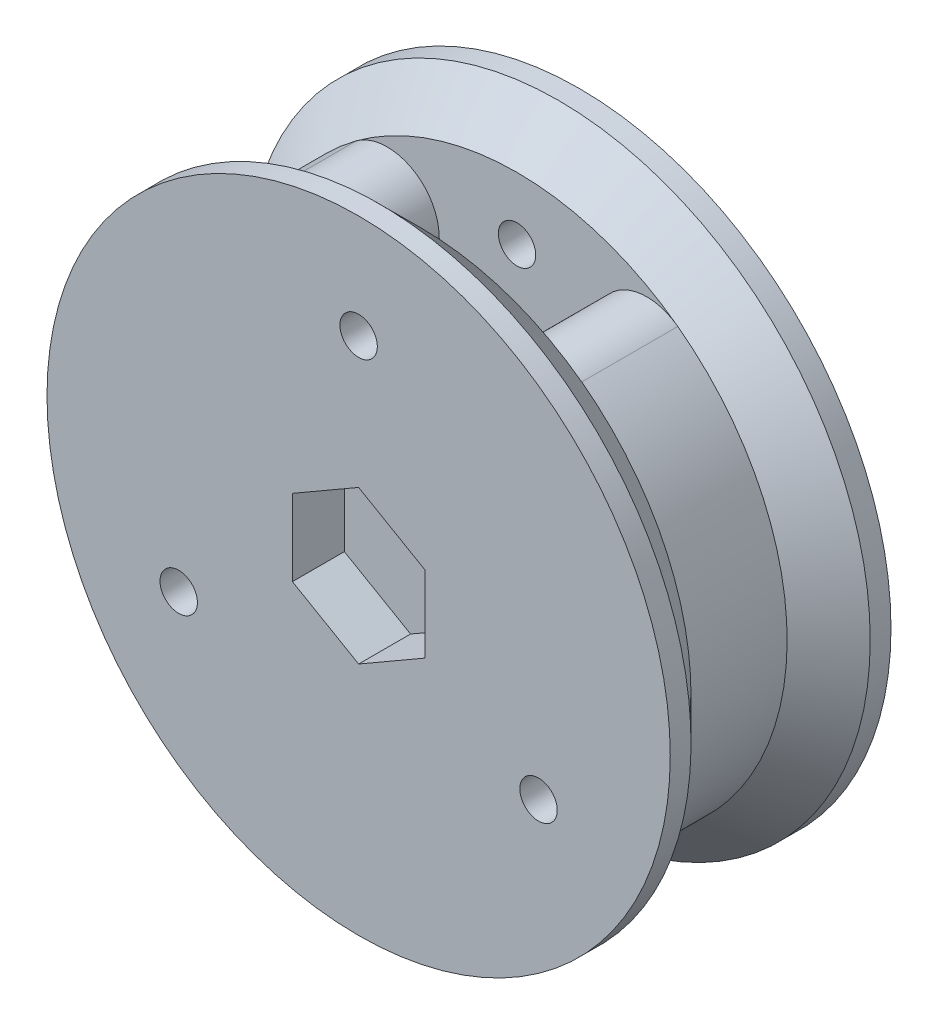
from build123d import *

# Parameters (mm, degrees)
SKETCH1_R           = 30
BOSS_EXTRUDE1_DEPTH = 21.25
CUT_EXTRUDE1_DEPTH  = 5
SKETCH5_R           = 1.8
CUT_EXTRUDE2_DEPTH  = 48.45063224
CUT_EXTRUDE3_DEPTH  = 13
SKETCH10_W          = 15
SKETCH10_H          = 9.25
CUT_EXTRUDE6_DEPTH  = 28
FILLET6_R           = 5
FILLET7_R           = 5


with BuildPart() as part:
    # Sketch1 → Boss-Extrude1 (new body)
    with BuildSketch(Plane.XY):
        Circle(SKETCH1_R)
    extrude(amount=BOSS_EXTRUDE1_DEPTH)

    # Sketch2 → Cut-Extrude1 (cut)
    with BuildSketch(Plane.XY.offset(21.25)):
        Polygon((0, 7.361215932), (-6.375, 3.680607966), (-6.375, -3.680607966), (0, -7.361215932), (6.375, -3.680607966), (6.375, 3.680607966), align=None)
    extrude(amount=-CUT_EXTRUDE1_DEPTH, mode=Mode.SUBTRACT)

    # Sketch4 → Cut-Revolve1 (revolve, cut)
    with BuildSketch(Plane(origin=(0, 0, 0), x_dir=(1, 0, 0), z_dir=(0, 1, 0)), mode=Mode.PRIVATE) as cut_revolve1_sk:
        Polygon((30, -19.25), (26, -15.25), (26, -6), (30, -2), align=None)
    revolve(cut_revolve1_sk.sketch.rotate(Axis((0, 0, -12.64061748), (0, 0, 1)), 180), axis=Axis((0, 0, -12.64061748), (0, 0, 1)), mode=Mode.SUBTRACT)

    # Sketch5 → Cut-Extrude2 (cut, through all)
    with BuildSketch(Plane.XY.offset(21.25)):
        with Locations((-17.320508076, -10)):
            Circle(SKETCH5_R)
        with Locations((17.320508076, -10)):
            Circle(SKETCH5_R)
        with Locations((0, 20)):
            Circle(SKETCH5_R)
    extrude(amount=-CUT_EXTRUDE2_DEPTH, mode=Mode.SUBTRACT)

    # Sketch6 → Cut-Extrude3 (cut)
    with BuildSketch(Plane(origin=(0, 0, 0), x_dir=(-1, 0, 0), z_dir=(0, 0, -1))):
        Polygon((7.361215932, 0), (3.680607966, 6.375), (-3.680607966, 6.375), (-7.361215932, 0), (-3.680607966, -6.375), (3.680607966, -6.375), align=None)
    extrude(amount=-CUT_EXTRUDE3_DEPTH, mode=Mode.SUBTRACT)

    # Sketch10 → Cut-Extrude6 (cut)
    with BuildSketch(Plane(origin=(0, 40, 0), x_dir=(1, 0, 0), z_dir=(0, 1, 0))):
        with Locations((0, -10.625)):
            Rectangle(SKETCH10_W, SKETCH10_H)
    extrude(amount=-CUT_EXTRUDE6_DEPTH, mode=Mode.SUBTRACT)

    # Fillet6
    fillet6_edges = [part.edges().sort_by_distance(p)[0] for p in [
        (-7.5, 24.894778569, 10.625),
        (7.5, 24.894778569, 10.625),
    ]]
    fillet(fillet6_edges, radius=FILLET6_R)

    # Fillet7
    fillet7_edges = [part.edges().sort_by_distance(p)[0] for p in [
        (7.5, 12, 10.625),
        (-7.5, 12, 10.625),
    ]]
    fillet(fillet7_edges, radius=FILLET7_R)


solid = part.part
